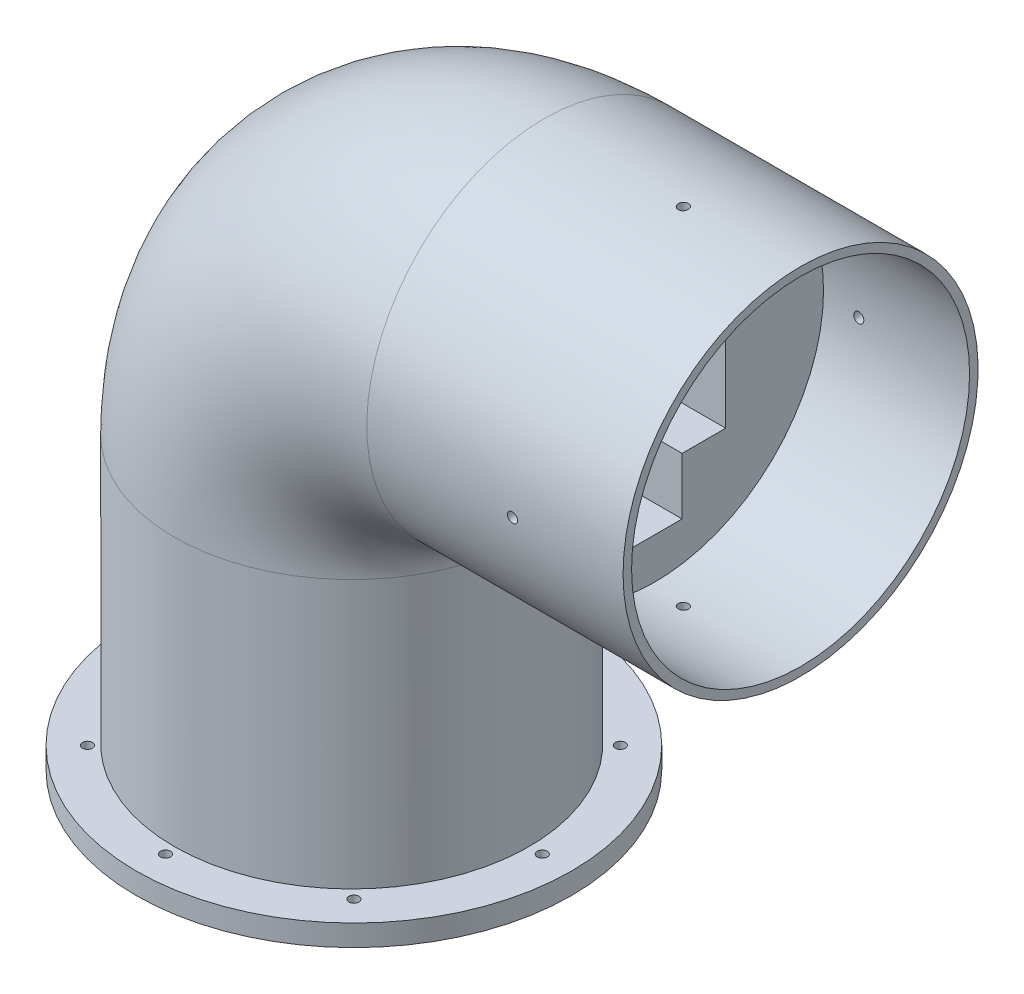
from build123d import *

# Parameters (mm, degrees)
SWEEP5_PROFILE_R         = 53
SHELL13_T                = -2.54
SKETCH19_R               = 65
BOSS_EXTRUDE1_DEPTH      = 6.35
SKETCH20_R               = 38.1
CUT_EXTRUDE1_DEPTH       = 6.35
BOSS_EXTRUDE2_DEPTH      = 10
BOSS_EXTRUDE2_DEPTH_BACK = 5
SKETCH24_R               = 50.225
SKETCH32_R               = 1.5
CUT_EXTRUDE3_DEPTH       = 210.043712111
CIRPATTERN1_COUNT        = 2
CIRPATTERN1_ANGLE        = 90
SKETCH49_R               = 1.5
CUT_EXTRUDE4_DEPTH       = 10
CIRPATTERN2_COUNT        = 8


with BuildPart() as part:
    # Sweep5: sweep along a path in Sketch4
    with BuildLine(Plane.XY) as sweep5_path:
        Line((-0.648967702, -43.236829834), (-0.648967702, 36.763170166))
        ThreePointArc((-0.648967702, 36.763170166), (16.19239238, 77.421810084), (56.851032298, 94.263170166))
        Line((56.851032298, 94.263170166), (133.371032298, 94.263170166))
    # Sweep5 profile (on start of the path) → Sweep5 (sweep)
    with BuildSketch(Plane(origin=(-0.648967702, -43.236829834, 0), x_dir=(1, 0, 0), z_dir=(0, 1, 0))):
        Circle(SWEEP5_PROFILE_R)
    sweep(path=sweep5_path.line)

    # Shell13
    shell13_openings = [part.faces().sort_by_distance(p)[0] for p in [
        (133.371032298, 94.263170166, 0),
        (-0.648967702, -43.236829834, 0),
    ]]
    offset(amount=SHELL13_T, openings=shell13_openings, kind=Kind.INTERSECTION)

    # Sketch19 → Boss-Extrude1 (add)
    with BuildSketch(Plane.XZ.offset(43.236829834)):
        Circle(SKETCH19_R)
    extrude(amount=BOSS_EXTRUDE1_DEPTH)

    # Sketch20 → Cut-Extrude1 (cut)
    with BuildSketch(Plane(origin=(0, -49.586829834, 0), x_dir=(-1, 0, 0), z_dir=(0, -1, 0))):
        with Locations(Location((0, 0, 0), (0, 0, 180))):
            Circle(SKETCH20_R)
    extrude(amount=-CUT_EXTRUDE1_DEPTH, mode=Mode.SUBTRACT)

    # Sketch32 → Cut-Extrude3 (cut, symmetric)
    with BuildSketch(Plane.XY):
        with Locations((100.323053648, 92.3007856)):
            Circle(SKETCH32_R)
    cut_extrude3 = extrude(amount=CUT_EXTRUDE3_DEPTH, both=True, mode=Mode.SUBTRACT)

    # CirPattern1: Cut-Extrude3 ×2 about axis
    cirpattern1_axis = Axis((133.371032298, 94.263170166, 0), (-1, 0, 0))
    for i in range(1, CIRPATTERN1_COUNT):
        add(cut_extrude3.rotate(cirpattern1_axis, i * CIRPATTERN1_ANGLE / (CIRPATTERN1_COUNT - 1)), mode=Mode.SUBTRACT)

    # Sketch49 → Cut-Extrude4 (cut)
    with BuildSketch(Plane.XZ.offset(49.586829834)):
        with Locations((0, 56.25)):
            Circle(SKETCH49_R)
    cut_extrude4 = extrude(amount=-CUT_EXTRUDE4_DEPTH, mode=Mode.SUBTRACT)

    # CirPattern2: Cut-Extrude4 ×8 about axis
    cirpattern2_axis = Axis((0, 0, 0), (0, 1, 0))
    for i in range(1, CIRPATTERN2_COUNT):
        add(cut_extrude4.rotate(cirpattern2_axis, i * 360 / CIRPATTERN2_COUNT), mode=Mode.SUBTRACT)


with BuildPart() as body_2:
    # Sketch24 → Boss-Extrude2 (new, two sides: drawn at the far end of the back side and taken through both)
    with BuildSketch(Plane(origin=(80, 0, 0), x_dir=(0, 0, -1), z_dir=(1, 0, 0)).offset(-BOSS_EXTRUDE2_DEPTH_BACK)):
        with Locations((0, 94.263170166)):
            Circle(SKETCH24_R)
        Polygon((-8, 73.263170166), (-8, 56.3007856), (8, 56.3007856), (8, 73.263170166), (21, 73.263170166), (21, 115.263170166), (-21, 115.263170166), (-21, 73.263170166), align=None, mode=Mode.SUBTRACT)
    extrude(amount=BOSS_EXTRUDE2_DEPTH + BOSS_EXTRUDE2_DEPTH_BACK)


solid = Compound([part.part, body_2.part])
